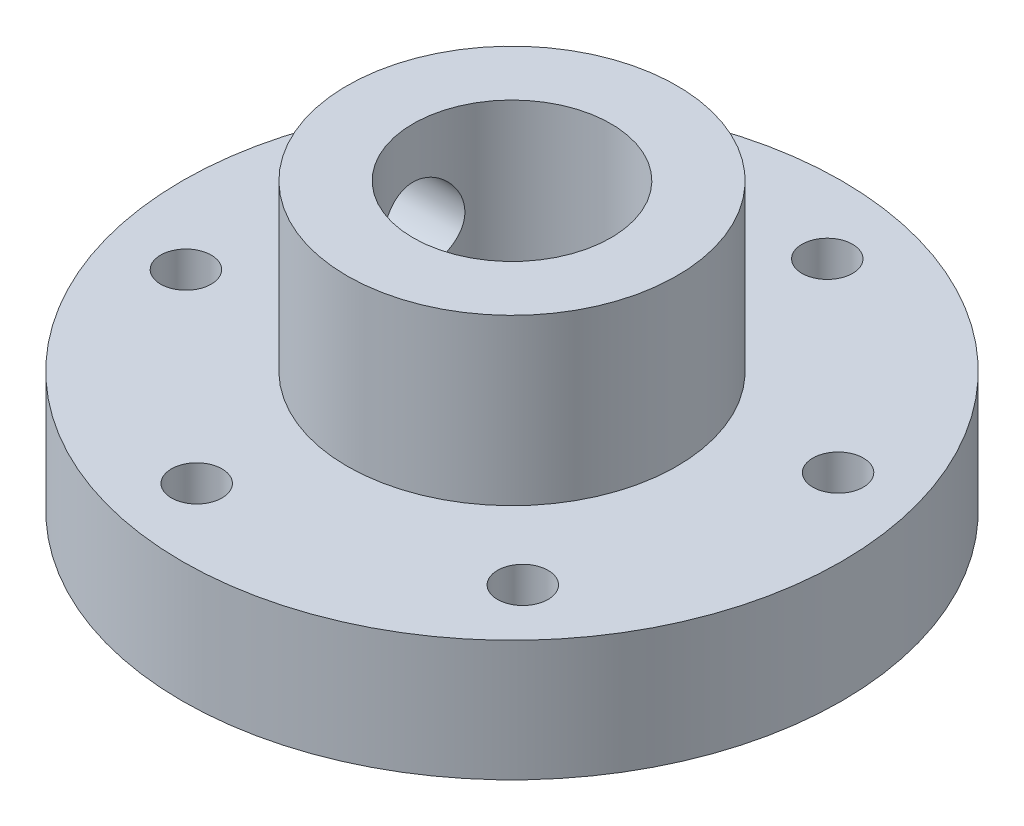
from build123d import *

# Parameters (mm, degrees)
SKETCH2_R               = 15
BOSS_EXTRUDE1_DEPTH     = 26
SKETCH1_R               = 30
BOSS_EXTRUDE2_DEPTH     = 11
SKETCH3_R               = 9
CUT_EXTRUDE1_DEPTH      = 50.759421218
SKETCH4_R               = 2.3
CUT_EXTRUDE2_DEPTH      = 46
CIRPATTERN1_COUNT       = 6
CUT_EXTRUDE3_REACH      = 51.759
CUT_EXTRUDE3_END_RADIUS = 15
SKETCH7_R               = 3.85


with BuildPart() as part:
    # Sketch2 → Boss-Extrude1 (new body)
    with BuildSketch(Plane(origin=(0, 0, 0), x_dir=(1, 0, 0), z_dir=(0, 1, 0))):
        with Locations(Location((0, 0, 0), (0, 0, 270))):
            Circle(SKETCH2_R)
    extrude(amount=BOSS_EXTRUDE1_DEPTH)

    # Sketch1 → Boss-Extrude2 (add)
    with BuildSketch(Plane(origin=(0, 0, 0), x_dir=(1, 0, 0), z_dir=(0, 1, 0))):
        with Locations(Location((0, 0, 0), (0, 0, 270))):
            Circle(SKETCH1_R)
    extrude(amount=BOSS_EXTRUDE2_DEPTH)

    # Sketch3 → Cut-Extrude1 (cut, through all)
    with BuildSketch(Plane(origin=(0, 26, 0), x_dir=(1, 0, 0), z_dir=(0, 1, 0))):
        with Locations(Location((0, 0, 0), (0, 0, 270))):
            Circle(SKETCH3_R)
    extrude(amount=-CUT_EXTRUDE1_DEPTH, mode=Mode.SUBTRACT)

    # Sketch4 → Cut-Extrude2 (cut, through all)
    with BuildSketch(Plane(origin=(0, 11, 0), x_dir=(1, 0, 0), z_dir=(0, 1, 0))):
        with Locations(Location((5.495034326, 23.192449843, 0), (0, 0, 270))):
            Circle(SKETCH4_R)
    cut_extrude2 = extrude(amount=-CUT_EXTRUDE2_DEPTH, mode=Mode.SUBTRACT)

    # CirPattern1: Cut-Extrude2 ×6 about axis
    cirpattern1_axis = Axis((0, 0, 0), (0, 1, 0))
    for i in range(1, CIRPATTERN1_COUNT):
        add(cut_extrude2.rotate(cirpattern1_axis, i * 360 / CIRPATTERN1_COUNT), mode=Mode.SUBTRACT)

    # Cut-Extrude3: up to this cylinder (the profile starts inside it)
    cut_extrude3_end = Plane(origin=(0, 17.55, 0), z_dir=(0, -1, 0)) * Cylinder(CUT_EXTRUDE3_END_RADIUS, 134.518, mode=Mode.PRIVATE)
    # Sketch7 → Cut-Extrude3 (cut, up to the surface)
    with BuildSketch(Plane(origin=(0, 0, 0), x_dir=(0, 0, -1), z_dir=(1, 0, 0)), mode=Mode.PRIVATE) as cut_extrude3_sk1:
        with Locations((0, 17.55)):
            Circle(SKETCH7_R)
    cut_extrude3_tool1 = extrude(cut_extrude3_sk1.sketch, amount=-CUT_EXTRUDE3_REACH, mode=Mode.PRIVATE) & cut_extrude3_end
    add(cut_extrude3_tool1.solids().sort_by_distance((0, 17.55, 0))[0], mode=Mode.SUBTRACT)


solid = part.part
